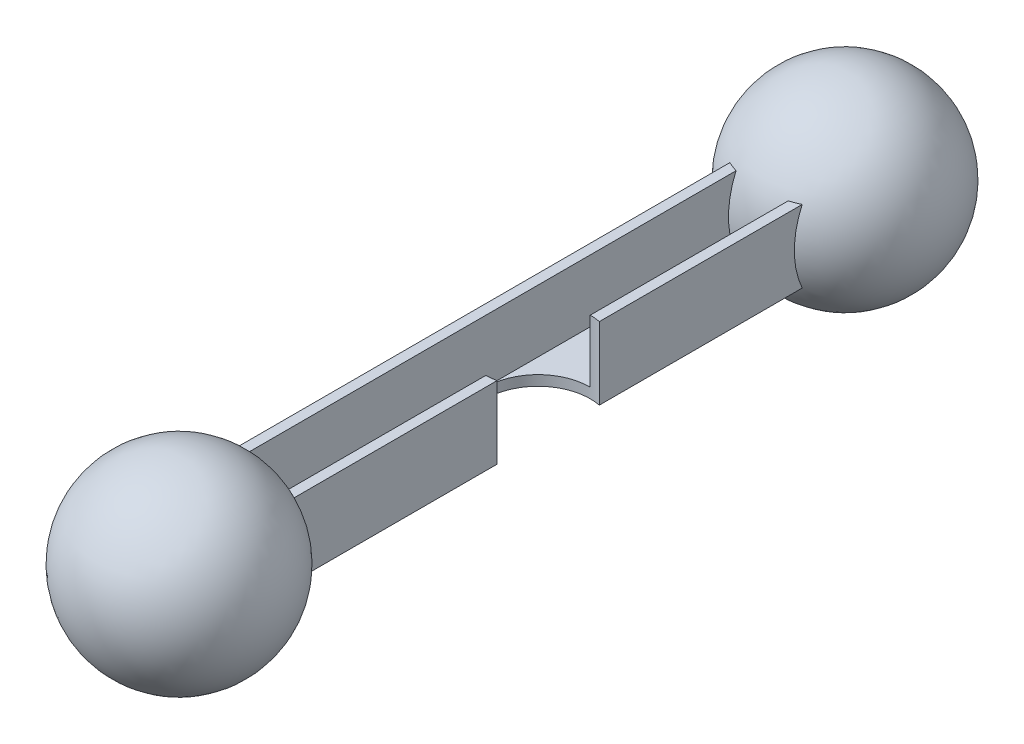
from build123d import *

# Parameters (mm, degrees)
BOSS_EXTRUDE1_DEPTH     = 115
CUT_EXTRUDE1_DEPTH      = 118.660110418
CUT_EXTRUDE1_DEPTH_BACK = 118.660110418
SKETCH2_R               = 18


with BuildPart() as part:
    # Sketch1 → Boss-Extrude1 (new, symmetric)
    with BuildSketch(Plane.XY):
        Polygon((-9.009337123, 12.5), (-9.009337123, -9.009337123), (9.009337123, -9.009337123), (9.009337123, 12.5), (12.5, 12.5), (12.5, -12.5), (-12.5, -12.5), (-12.5, 12.5), align=None)
    extrude(amount=BOSS_EXTRUDE1_DEPTH, both=True)

    # Sketch2 → Cut-Extrude1 (cut, two sides: drawn at the far end of the back side and taken through both)
    with BuildSketch(Plane(origin=(0, -9.009337123, 0), x_dir=(1, 0, 0), z_dir=(0, 1, 0)).offset(-CUT_EXTRUDE1_DEPTH_BACK)):
        with Locations((8.990662877, 0)):
            Circle(SKETCH2_R)
    extrude(amount=CUT_EXTRUDE1_DEPTH + CUT_EXTRUDE1_DEPTH_BACK, mode=Mode.SUBTRACT)

    # Sketch3 → Revolve1 (revolve)
    with BuildSketch(Plane.XY.offset(115)):
        with BuildLine():
            Line((0, 32.5), (0, -32.5))
            ThreePointArc((0, -32.5), (32.5, 0), (0, 32.5))
        make_face()
    revolve1 = revolve(axis=Axis((0, 32.5, 115), (0, -1, 0)))

    # Mirror1: Revolve1 across plane
    add(revolve1.mirror(Plane.XY))


solid = part.part
